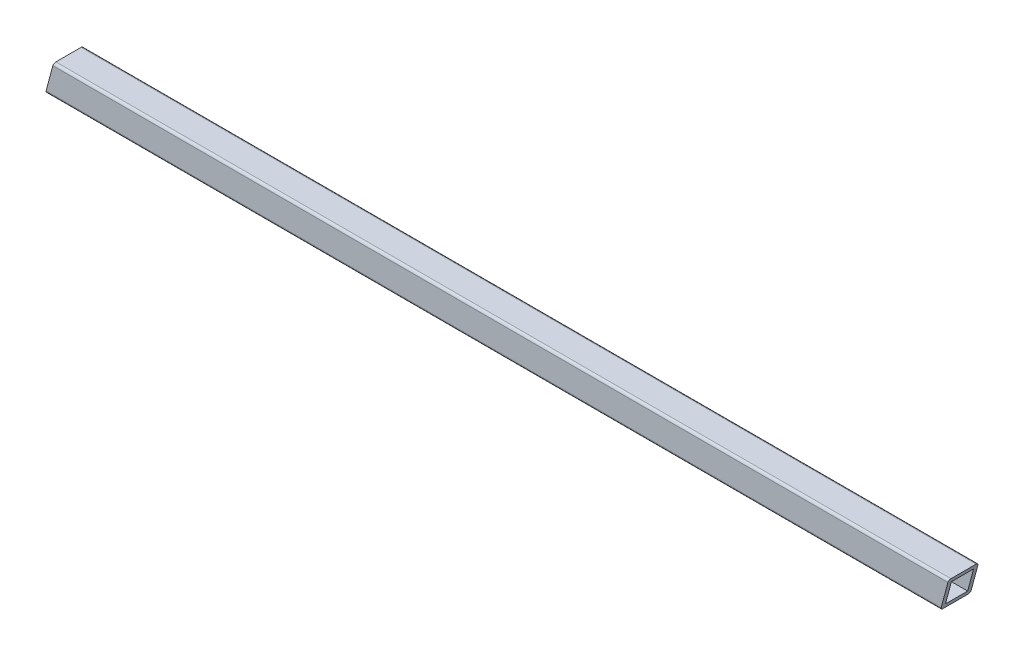
from build123d import *

# Parameters (mm, degrees)
SKETCH1_W           = 23.495
SKETCH1_H           = 23.495
BOSS_EXTRUDE1_DEPTH = 1320.8
SCALE2_SCALE_X      = 1
SCALE2_SCALE_Y      = 0.4
SCALE2_SCALE_Z      = 0.4
CUT_EXTRUDE1_DEPTH  = 1322.04802369
CUT_EXTRUDE2_DEPTH  = 1322.04802369


with BuildPart() as part:
    # Sketch1 → Boss-Extrude1 (new body)
    with BuildSketch(Plane(origin=(0, 0, 0), x_dir=(0, 0, -1), z_dir=(1, 0, 0))):
        with BuildLine():
            Line((0, 2.54), (0, 29.21))
            ThreePointArc((0, 29.21), (-0.743948776, 31.006051224), (-2.54, 31.75))
            Line((-2.54, 31.75), (-29.21, 31.75))
            ThreePointArc((-29.21, 31.75), (-31.006051224, 31.006051224), (-31.75, 29.21))
            Line((-31.75, 29.21), (-31.75, 2.54))
            ThreePointArc((-31.75, 2.54), (-31.006051224, 0.743948776), (-29.21, 0))
            Line((-29.21, 0), (-2.54, 0))
            ThreePointArc((-2.54, 0), (-0.743948776, 0.743948776), (0, 2.54))
        make_face()
        with Locations((-15.875, 15.875)):
            Rectangle(SKETCH1_W, SKETCH1_H, mode=Mode.SUBTRACT)
    extrude(amount=BOSS_EXTRUDE1_DEPTH)


with BuildPart() as part_1:
    # Scale2: scaled about (660.4, 15.875, 15.875)
    add(part.part.scale((SCALE2_SCALE_X, SCALE2_SCALE_Y, SCALE2_SCALE_Z), about=(660.4, 15.875, 15.875)))

    # Sketch3 → Cut-Extrude1 (cut, through all)
    with BuildSketch(Plane.XY.offset(22.225)):
        Polygon((861.354778809, 22.225), (857.951824065, 9.525), (846.963573515, 9.525), (846.963573515, 22.225), align=None)
    extrude(amount=-CUT_EXTRUDE1_DEPTH, mode=Mode.SUBTRACT)


with BuildPart() as cut_extrude1_kept_piece:
    # of the separate pieces the step leaves, the one the design keeps (cut_extrude1_pieces_kept)
    add(part_1.part.solids().sort_by_distance((861.08254243, 21.209, 9.525))[0])

    # Sketch4 → Cut-Extrude2 (cut, through all)
    with BuildSketch(Plane.XY.offset(22.225)):
        Polygon((1236.839927048, 9.525), (1320.8, 9.525), (1320.8, 22.225), (1240.242881792, 22.225), align=None)
    extrude(amount=-CUT_EXTRUDE2_DEPTH, mode=Mode.SUBTRACT)


solid = cut_extrude1_kept_piece.part
